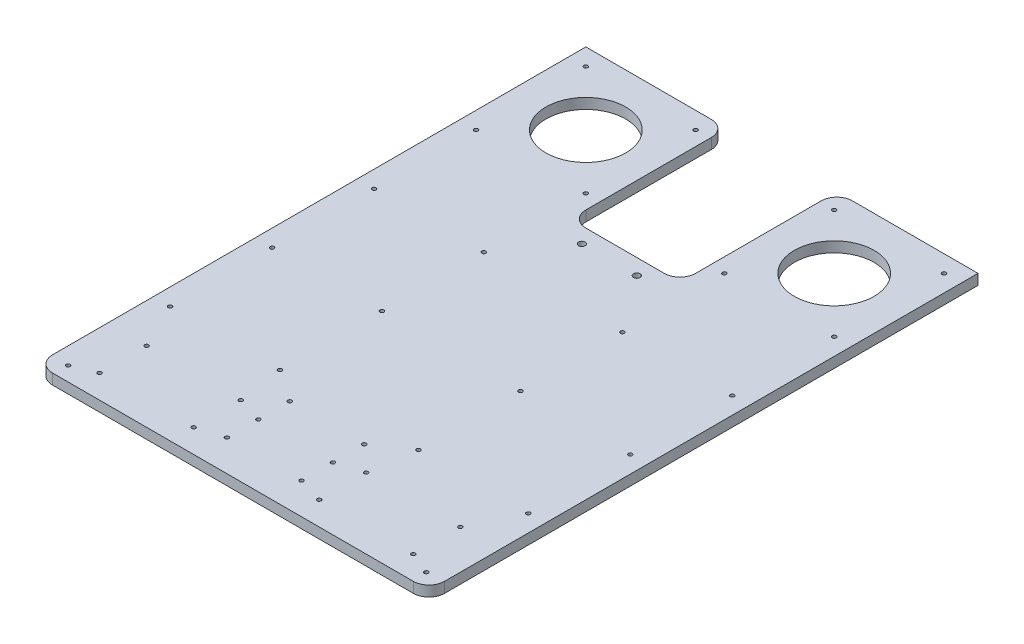
from build123d import *

# Parameters (mm, degrees)
SKETCH1_R           = 2.5
SKETCH1_R_2         = 1.5
SKETCH1_R_3         = 30.5
BOSS_EXTRUDE1_DEPTH = 8
FILLET1_R           = 12


with BuildPart() as part:
    # Sketch1 → Boss-Extrude1 (new body)
    with BuildSketch(Plane(origin=(0, 0, 0), x_dir=(1, 0, 0), z_dir=(0, 1, 0))):
        Polygon((-150, -210), (150, -210), (150, 210), (42, 210), (42, 90), (0, 90), (-42, 90), (-42, 210), (-150, 210), align=None)
        with Locations(Location((-21, 78, 0), (0, 0, 270))):
            Circle(SKETCH1_R, mode=Mode.SUBTRACT)
        with Locations(Location((21, 78, 0), (0, 0, 90))):
            Circle(SKETCH1_R, mode=Mode.SUBTRACT)
        with Locations(Location((-28.5, -138, 0), (0, 0, 270))):
            Circle(SKETCH1_R_2, mode=Mode.SUBTRACT)
        with Locations(Location((-28.5, -162, 0), (0, 0, 270))):
            Circle(SKETCH1_R_2, mode=Mode.SUBTRACT)
        with Locations(Location((-28.5, -186, 0), (0, 0, 270))):
            Circle(SKETCH1_R_2, mode=Mode.SUBTRACT)
        with Locations(Location((28.5, -186, 0), (0, 0, 90))):
            Circle(SKETCH1_R_2, mode=Mode.SUBTRACT)
        with Locations(Location((28.5, -162, 0), (0, 0, 90))):
            Circle(SKETCH1_R_2, mode=Mode.SUBTRACT)
        with Locations(Location((28.5, -138, 0), (0, 0, 90))):
            Circle(SKETCH1_R_2, mode=Mode.SUBTRACT)
        with Locations(Location((-95, 155, 0), (0, 0, 270))):
            Circle(SKETCH1_R_3, mode=Mode.SUBTRACT)
        with Locations(Location((-137, 197, 0), (0, 0, 270))):
            Circle(SKETCH1_R_2, mode=Mode.SUBTRACT)
        with Locations(Location((-53, 197, 0), (0, 0, 270))):
            Circle(SKETCH1_R_2, mode=Mode.SUBTRACT)
        with Locations(Location((-53, 113, 0), (0, 0, 270))):
            Circle(SKETCH1_R_2, mode=Mode.SUBTRACT)
        with Locations(Location((-137, 113, 0), (0, 0, 270))):
            Circle(SKETCH1_R_2, mode=Mode.SUBTRACT)
        with Locations(Location((-137, 35, 0), (0, 0, 270))):
            Circle(SKETCH1_R_2, mode=Mode.SUBTRACT)
        with Locations(Location((-137, -43, 0), (0, 0, 270))):
            Circle(SKETCH1_R_2, mode=Mode.SUBTRACT)
        with Locations(Location((-137, -121, 0), (0, 0, 270))):
            Circle(SKETCH1_R_2, mode=Mode.SUBTRACT)
        with Locations(Location((137, -121, 0), (0, 0, 90))):
            Circle(SKETCH1_R_2, mode=Mode.SUBTRACT)
        with Locations(Location((137, -43, 0), (0, 0, 90))):
            Circle(SKETCH1_R_2, mode=Mode.SUBTRACT)
        with Locations(Location((137, 35, 0), (0, 0, 90))):
            Circle(SKETCH1_R_2, mode=Mode.SUBTRACT)
        with Locations(Location((53, 197, 0), (0, 0, 90))):
            Circle(SKETCH1_R_2, mode=Mode.SUBTRACT)
        with Locations(Location((137, 197, 0), (0, 0, 90))):
            Circle(SKETCH1_R_2, mode=Mode.SUBTRACT)
        with Locations(Location((137, 113, 0), (0, 0, 90))):
            Circle(SKETCH1_R_2, mode=Mode.SUBTRACT)
        with Locations(Location((95, 155, 0), (0, 0, 90))):
            Circle(SKETCH1_R_3, mode=Mode.SUBTRACT)
        with Locations(Location((53, 113, 0), (0, 0, 90))):
            Circle(SKETCH1_R_2, mode=Mode.SUBTRACT)
        with Locations(Location((-53, 35, 0), (0, 0, 270))):
            Circle(SKETCH1_R_2, mode=Mode.SUBTRACT)
        with Locations(Location((-53, -43, 0), (0, 0, 270))):
            Circle(SKETCH1_R_2, mode=Mode.SUBTRACT)
        with Locations(Location((-53, -121, 0), (0, 0, 270))):
            Circle(SKETCH1_R_2, mode=Mode.SUBTRACT)
        with Locations(Location((53, -121, 0), (0, 0, 90))):
            Circle(SKETCH1_R_2, mode=Mode.SUBTRACT)
        with Locations(Location((53, -43, 0), (0, 0, 90))):
            Circle(SKETCH1_R_2, mode=Mode.SUBTRACT)
        with Locations(Location((53, 35, 0), (0, 0, 90))):
            Circle(SKETCH1_R_2, mode=Mode.SUBTRACT)
        with Locations(Location((-137, -199, 0), (0, 0, 270))):
            Circle(SKETCH1_R_2, mode=Mode.SUBTRACT)
        with Locations(Location((137, -199, 0), (0, 0, 90))):
            Circle(SKETCH1_R_2, mode=Mode.SUBTRACT)
        with Locations(Location((-120, -192, 0), (0, 0, 270))):
            Circle(SKETCH1_R_2, mode=Mode.SUBTRACT)
        with Locations(Location((-48, -192, 0), (0, 0, 270))):
            Circle(SKETCH1_R_2, mode=Mode.SUBTRACT)
        with Locations(Location((-48, -156, 0), (0, 0, 270))):
            Circle(SKETCH1_R_2, mode=Mode.SUBTRACT)
        with Locations(Location((-120, -156, 0), (0, 0, 270))):
            Circle(SKETCH1_R_2, mode=Mode.SUBTRACT)
        with Locations(Location((48, -156, 0), (0, 0, 90))):
            Circle(SKETCH1_R_2, mode=Mode.SUBTRACT)
        with Locations(Location((48, -192, 0), (0, 0, 90))):
            Circle(SKETCH1_R_2, mode=Mode.SUBTRACT)
        with Locations(Location((120, -192, 0), (0, 0, 90))):
            Circle(SKETCH1_R_2, mode=Mode.SUBTRACT)
        with Locations(Location((120, -156, 0), (0, 0, 90))):
            Circle(SKETCH1_R_2, mode=Mode.SUBTRACT)
    extrude(amount=BOSS_EXTRUDE1_DEPTH)

    # Fillet1
    fillet1_edges = [part.edges().sort_by_distance(p)[0] for p in [
        (150, 4, 210),
        (-150, 4, 210),
        (-42, 4, -210),
        (-42, 4, -90),
        (42, 4, -90),
        (42, 4, -210),
    ]]
    fillet(fillet1_edges, radius=FILLET1_R)


solid = part.part
